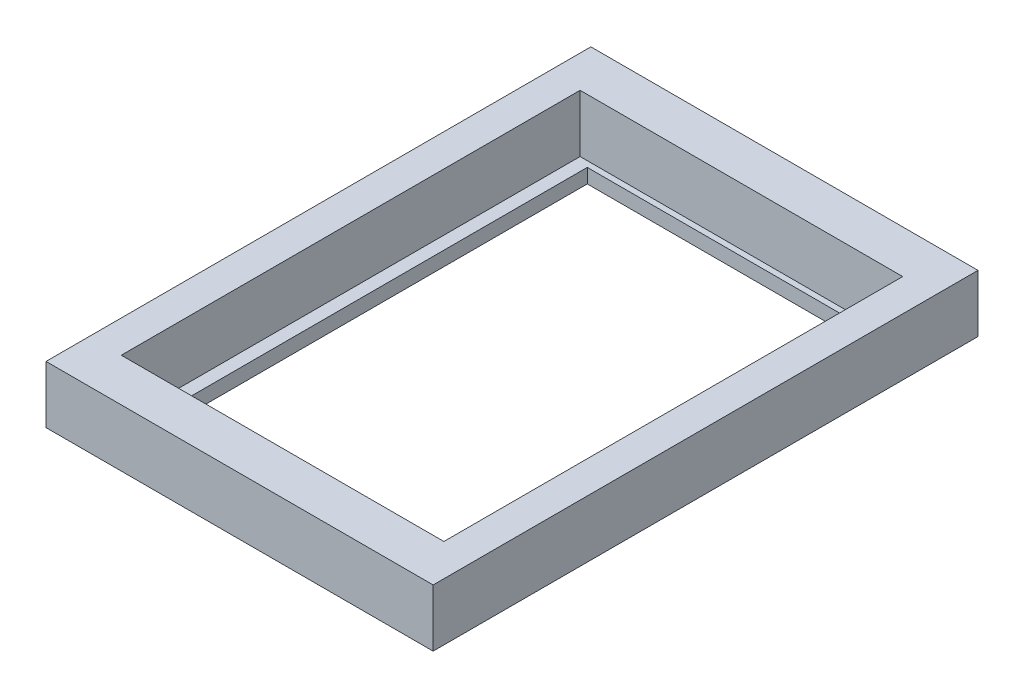
from build123d import *

# Parameters (mm, degrees)
SKETCH3_W           = 108
SKETCH3_H           = 152
BOSS_EXTRUDE1_DEPTH = 16
SKETCH7_W           = 98
SKETCH7_H           = 138
BOSS_EXTRUDE2_DEPTH = 4
SKETCH5_W           = 82.75
SKETCH5_H           = 124.75
CUT_EXTRUDE1_DEPTH  = 96.351979528
SKETCH6_W           = 90
SKETCH6_H           = 128
CUT_EXTRUDE2_DEPTH  = 16


with BuildPart() as part:
    # Sketch3 → Boss-Extrude1 (new body)
    with BuildSketch(Plane(origin=(0, 0, 0), x_dir=(1, 0, 0), z_dir=(0, 1, 0))):
        Rectangle(SKETCH3_W, SKETCH3_H)
    extrude(amount=BOSS_EXTRUDE1_DEPTH)

    # Sketch7 → Boss-Extrude2 (add)
    with BuildSketch(Plane.XZ):
        Rectangle(SKETCH7_W, SKETCH7_H)
    extrude(amount=BOSS_EXTRUDE2_DEPTH)

    # Sketch5 → Cut-Extrude1 (cut, through all)
    with BuildSketch(Plane(origin=(0, 16, 0), x_dir=(1, 0, 0), z_dir=(0, 1, 0))):
        Rectangle(SKETCH5_W, SKETCH5_H)
    extrude(amount=-CUT_EXTRUDE1_DEPTH, mode=Mode.SUBTRACT)

    # Sketch6 → Cut-Extrude2 (cut)
    with BuildSketch(Plane(origin=(0, 16, 0), x_dir=(1, 0, 0), z_dir=(0, 1, 0))):
        Rectangle(SKETCH6_W, SKETCH6_H)
    extrude(amount=-CUT_EXTRUDE2_DEPTH, mode=Mode.SUBTRACT)


solid = part.part
